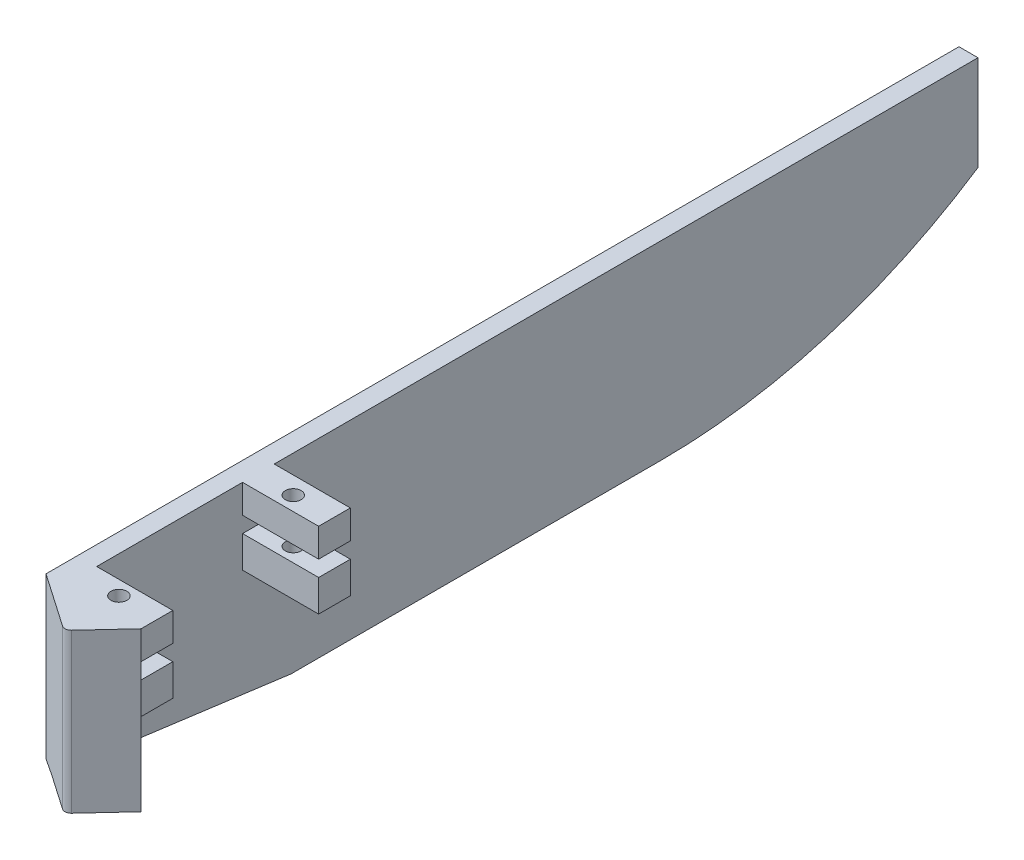
from build123d import *

# Parameters (mm, degrees)
SKETCH_1_W          = 150
SKETCH_1_H          = 30
EXTRUDE_1_DEPTH     = 3
SKETCH_2_W          = 5
SKETCH_2_H          = 4.5
SKETCH_2_H_2        = 5
EXTRUDE_2_DEPTH     = 12
SKETCH_3_R          = 1.25
CUT_EXTRUDE_1_DEPTH = 12
CUT_EXTRUDE_2_DEPTH = 33
SKETCH_6_W          = 12
SKETCH_6_H          = 5
CUT_EXTRUDE_3_DEPTH = 14
CUT_EXTRUDE_4_DEPTH = 14
CUT_EXTRUDE_5_DEPTH = 14


with BuildPart() as part:
    # 草图1 → 凸台-拉伸1 (new body)
    with BuildSketch(Plane(origin=(0, 0, 0), x_dir=(0, 0, -1), z_dir=(1, 0, 0))):
        with Locations((75, 15)):
            Rectangle(SKETCH_1_W, SKETCH_1_H)
    extrude(amount=EXTRUDE_1_DEPTH)

    # 草图2 → 凸台-拉伸2 (add)
    with BuildSketch(Plane(origin=(3, 0, 0), x_dir=(0, 0, -1), z_dir=(1, 0, 0))):
        Polygon((6, 30), (11, 30), (11, 25.500001474), (6.003642258, 25.500001474), (6.003642258, 23.000001474), (11.003642258, 23.000001474), (11.003642258, 18.000001474), (6.003642258, 18.000001474), (6.003642258, 0), (0, 0), (0, 30), align=None)
        with Locations((36.5, 27.75)):
            Rectangle(SKETCH_2_W, SKETCH_2_H)
        with Locations((36.503642258, 20.500001474)):
            Rectangle(SKETCH_2_W, SKETCH_2_H_2)
    extrude(amount=EXTRUDE_2_DEPTH)

    # 草图3 → 切除-拉伸1 (cut)
    with BuildSketch(Plane(origin=(0, 30, 0), x_dir=(1, 0, 0), z_dir=(0, 1, 0))):
        with Locations(Location((8.75, 36.25, 0), (0, 0, 270))):
            Circle(SKETCH_3_R)
        with Locations(Location((8.75, 8.75, 0), (0, 0, 270))):
            Circle(SKETCH_3_R)
    extrude(amount=-CUT_EXTRUDE_1_DEPTH, mode=Mode.SUBTRACT)

    # 草图5 → 切除-拉伸2 (cut)
    with BuildSketch(Plane(origin=(0, 30, 0), x_dir=(1, 0, 0), z_dir=(0, 1, 0))):
        with BuildLine():
            Line((0, 0), (9, 0))
            ThreePointArc((9, 0), (8.702388097, 0.045313059), (8.431747605, 0.17714569))
            Line((8.431747605, 0.17714569), (0, 6))
            Line((0, 6), (0, 0))
        make_face()
        with BuildLine():
            Line((15, 0), (15, 6))
            Line((15, 6), (9.733275958, 0.32006885))
            ThreePointArc((9.733275958, 0.32006885), (9.400043029, 0.083503642), (9, 0))
            Line((9, 0), (15, 0))
        make_face()
    extrude(amount=-CUT_EXTRUDE_2_DEPTH, mode=Mode.SUBTRACT)

    # 草图6 → 切除-拉伸3 (cut)
    with BuildSketch(Plane(origin=(0, 0, -6.003642258), x_dir=(-1, 0, 0), z_dir=(0, 0, -1))):
        with Locations((-9, 2.5)):
            Rectangle(SKETCH_6_W, SKETCH_6_H)
    extrude(amount=-CUT_EXTRUDE_3_DEPTH, mode=Mode.SUBTRACT)

    # 草图7 → 切除-拉伸4 (cut)
    with BuildSketch(Plane(origin=(3, 0, 0), x_dir=(0, 0, -1), z_dir=(1, 0, 0))):
        Polygon((41.659631445, 0), (3.928239346, 0), (3.928239346, 5), align=None)
    extrude(amount=-CUT_EXTRUDE_4_DEPTH, mode=Mode.SUBTRACT)

    # 草图8 → 切除-拉伸5 (cut)
    with BuildSketch(Plane(origin=(3, 0, 0), x_dir=(0, 0, -1), z_dir=(1, 0, 0))):
        with BuildLine():
            Line((100, 0), (150, 0))
            Line((150, 0), (150, 15))
            ThreePointArc((150, 15), (126.100766272, 3.830779092), (100, 0))
        make_face()
    extrude(amount=-CUT_EXTRUDE_5_DEPTH, mode=Mode.SUBTRACT)


solid = part.part
